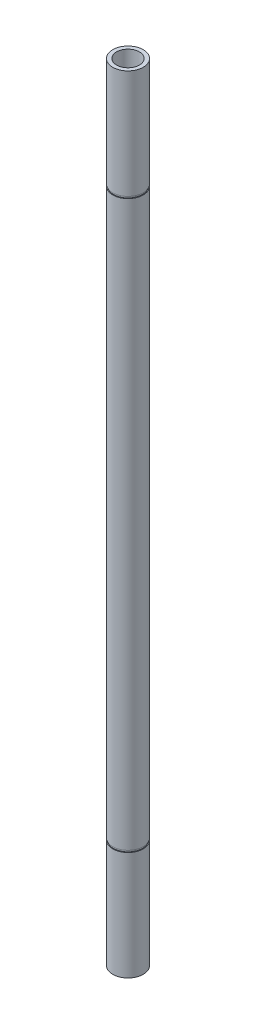
from build123d import *


with BuildPart() as part:
    # Sketch1 → Revolve2 (revolve)
    with BuildSketch(Plane.XY, mode=Mode.PRIVATE) as revolve2_sk:
        Polygon((-3, 103), (-4, 103), (-4, 74.5), (-3.8, 74.5), (-3.8, 74), (-4, 74), (-4, -74), (-3.8, -74), (-3.8, -74.5), (-4, -74.5), (-4, -103), (-3, -103), align=None)
    revolve(revolve2_sk.sketch.rotate(Axis((0, 64.302267184, 0), (0, -1, 0)), 270), axis=Axis((0, 64.302267184, 0), (0, -1, 0)))


solid = part.part
